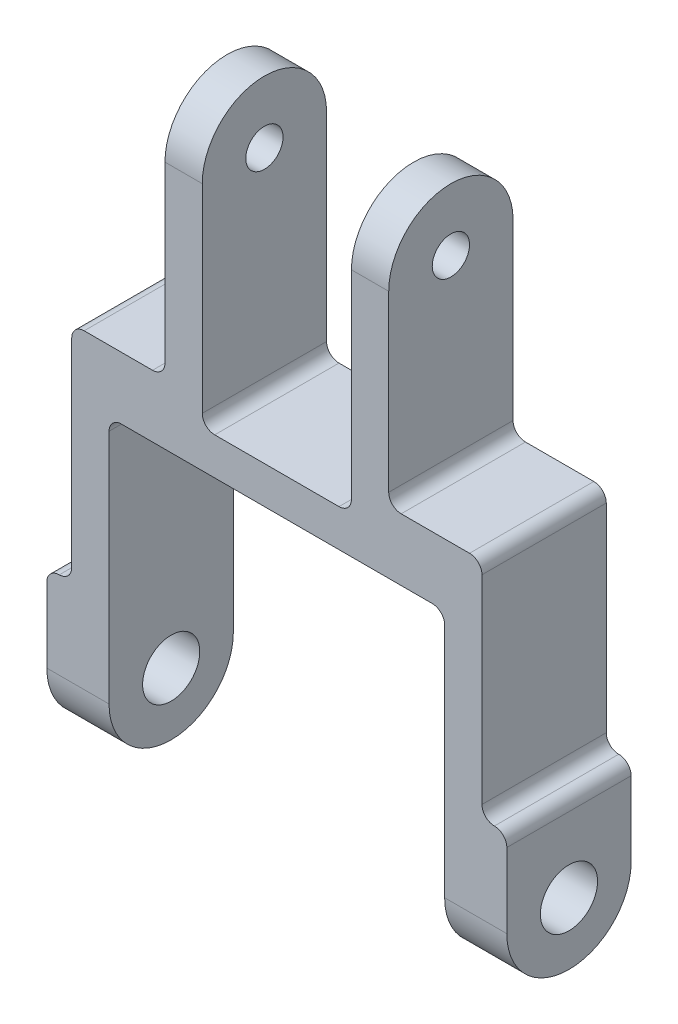
from build123d import *

# Parameters (mm, degrees)
BOSS_EXTRU_1_DEPTH      = 10
ESQUISSE2_R             = 1.5
ESQUISSE2_R_2           = 2.3
ENL_V_MAT_EXTRU_1_DEPTH = 54.203009486


with BuildPart() as part:
    # Esquisse1 → Boss.-Extru.1 (new body)
    with BuildSketch(Plane.XY):
        with BuildLine():
            Line((-17.240327137, -13.100674555), (-17.240327137, -2.100674555))
            ThreePointArc((-17.240327137, -2.100674555), (-16.947433918, -1.393567773), (-16.240327137, -1.100674555))
            ThreePointArc((-16.240327137, -1.100674555), (-15.533220355, -0.807781336), (-15.240327137, -0.100674555))
            Line((-15.240327137, -0.100674555), (-15.240327137, 15.899325445))
            ThreePointArc((-15.240327137, 15.899325445), (-14.947433918, 16.606432227), (-14.240327137, 16.899325445))
            Line((-14.240327137, 16.899325445), (-8.740327137, 16.899325445))
            ThreePointArc((-8.740327137, 16.899325445), (-8.033220355, 17.192218664), (-7.740327137, 17.899325445))
            Line((-7.740327137, 17.899325445), (-7.740327137, 36.899325445))
            Line((-7.740327137, 36.899325445), (-4.740327137, 36.899325445))
            Line((-4.740327137, 36.899325445), (-4.740327137, 15.899325445))
            ThreePointArc((-4.740327137, 15.899325445), (-4.447433918, 15.192218664), (-3.740327137, 14.899325445))
            Line((-3.740327137, 14.899325445), (6.259672863, 14.899325445))
            ThreePointArc((6.259672863, 14.899325445), (6.966779645, 15.192218664), (7.259672863, 15.899325445))
            Line((7.259672863, 15.899325445), (7.259672863, 36.899325445))
            Line((7.259672863, 36.899325445), (10.259672863, 36.899325445))
            Line((10.259672863, 36.899325445), (10.259672863, 17.899325445))
            ThreePointArc((10.259672863, 17.899325445), (10.552566082, 17.192218664), (11.259672863, 16.899325445))
            Line((11.259672863, 16.899325445), (16.759672863, 16.899325445))
            ThreePointArc((16.759672863, 16.899325445), (17.466779645, 16.606432227), (17.759672863, 15.899325445))
            Line((17.759672863, 15.899325445), (17.759672863, -0.100674555))
            ThreePointArc((17.759672863, -0.100674555), (18.052566082, -0.807781336), (18.759672863, -1.100674555))
            ThreePointArc((18.759672863, -1.100674555), (19.466779645, -1.393567773), (19.759672863, -2.100674555))
            Line((19.759672863, -2.100674555), (19.759672863, -13.100674555))
            Line((19.759672863, -13.100674555), (14.759672863, -13.100674555))
            Line((14.759672863, -13.100674555), (14.759672863, 10.899325445))
            ThreePointArc((14.759672863, 10.899325445), (14.466779645, 11.606432227), (13.759672863, 11.899325445))
            Line((13.759672863, 11.899325445), (-11.240327137, 11.899325445))
            ThreePointArc((-11.240327137, 11.899325445), (-11.947433918, 11.606432227), (-12.240327137, 10.899325445))
            Line((-12.240327137, 10.899325445), (-12.240327137, -13.100674555))
            Line((-12.240327137, -13.100674555), (-17.240327137, -13.100674555))
        make_face()
    extrude(amount=BOSS_EXTRU_1_DEPTH)

    # Esquisse2 → Enlèv. mat.-Extru.1 (cut, through all)
    with BuildSketch(Plane.ZY.offset(17.240327137)):
        with BuildLine():
            Line((0, 36.899325445), (0, 31.899325445))
            ThreePointArc((0, 31.899325445), (1.464466094, 35.434859351), (5, 36.899325445))
            Line((5, 36.899325445), (0, 36.899325445))
        make_face()
        with BuildLine():
            Line((10, 36.899325445), (5, 36.899325445))
            ThreePointArc((5, 36.899325445), (8.535533906, 35.434859351), (10, 31.899325445))
            Line((10, 31.899325445), (10, 36.899325445))
        make_face()
        with BuildLine():
            ThreePointArc((10, -8.100674555), (8.535533906, -11.636208461), (5, -13.100674555))
            Line((5, -13.100674555), (10, -13.100674555))
            Line((10, -13.100674555), (10, -8.100674555))
        make_face()
        with BuildLine():
            ThreePointArc((5, -13.100674555), (1.464466094, -11.636208461), (0, -8.100674555))
            Line((0, -8.100674555), (0, -13.100674555))
            Line((0, -13.100674555), (5, -13.100674555))
        make_face()
        with Locations(Location((5, 31.899325445, 0), (0, 0, 90))):
            Circle(ESQUISSE2_R)
        with Locations((5, -8.100674555)):
            Circle(ESQUISSE2_R_2)
    extrude(amount=-ENL_V_MAT_EXTRU_1_DEPTH, mode=Mode.SUBTRACT)


solid = part.part
